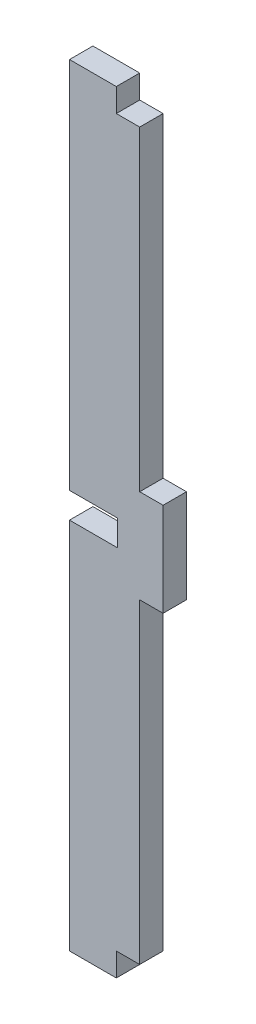
from build123d import *

# Parameters (mm, degrees)
BOSS_EXTRUDE1_DEPTH = 2.5


with BuildPart() as part:
    # Sketch2 → Boss-Extrude1 (new, symmetric)
    with BuildSketch(Plane.XY):
        Polygon((-326.454340614, -53.941167375), (-326.454340614, -48.941167375), (-336.454340614, -48.941167375), (-336.454340614, -128.691167375), (-326.204340614, -128.691167375), (-326.204340614, -134.191167375), (-336.454340614, -134.191167375), (-336.454340614, -213.941167375), (-326.454340614, -213.941167375), (-326.454340614, -208.941167375), (-321.454340614, -208.941167375), (-321.454340614, -141.441167375), (-316.454340614, -141.441167375), (-316.454340614, -121.441167375), (-321.454340614, -121.441167375), (-321.454340614, -53.941167375), align=None)
    extrude(amount=BOSS_EXTRUDE1_DEPTH, both=True)


solid = part.part
